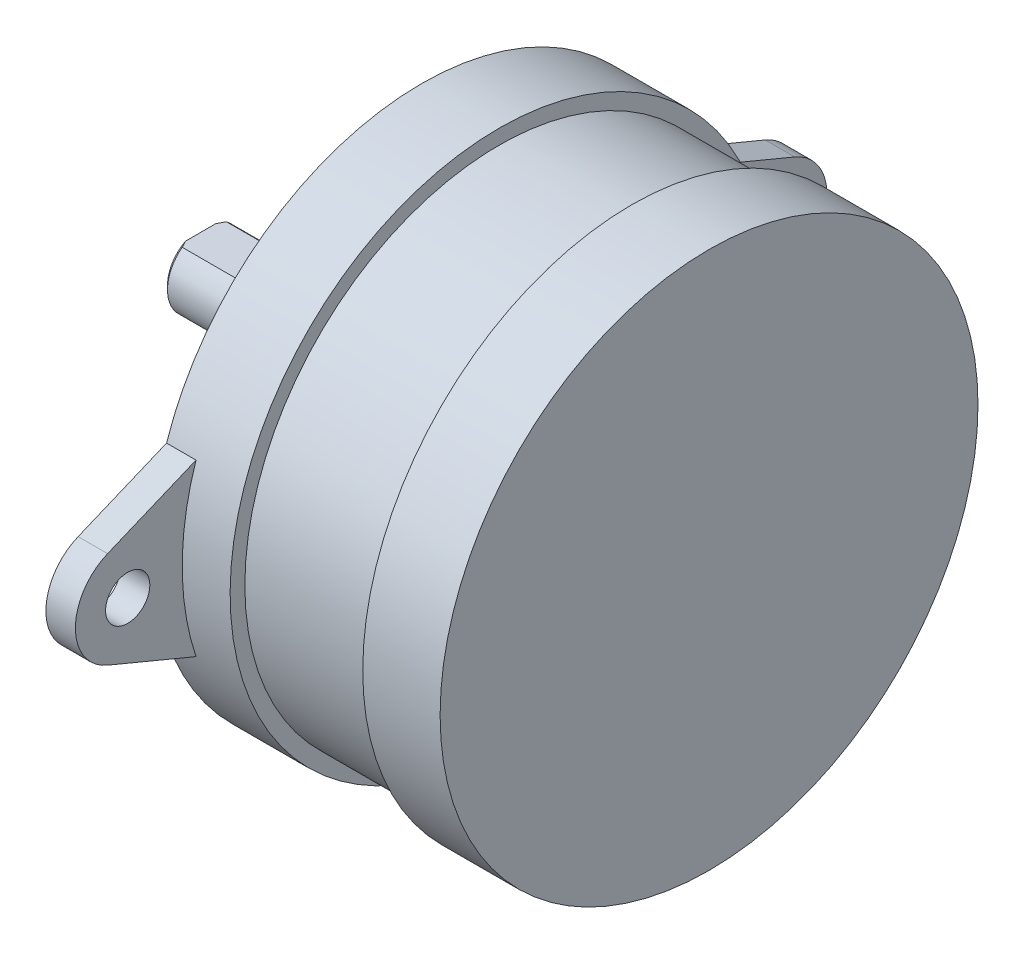
from build123d import *

# Parameters (mm, degrees)
ESQUISSE2_R             = 18.25
BOSS_EXTRU_1_DEPTH      = 5.25
ESQUISSE3_R             = 17.25
BOSS_EXTRU_2_DEPTH      = 9
ESQUISSE4_R             = 18.25
BOSS_EXTRU_3_DEPTH      = 5.25
ESQUISSE6_R             = 1.5
BOSS_EXTRU_4_DEPTH      = 2
ESQUISSE7_R             = 8
BOSS_EXTRU_5_DEPTH      = 2
ESQUISSE8_R             = 2.5
BOSS_EXTRU_6_DEPTH      = 15
CHANFREIN1_SIZE         = 0.25
ESQUISSE9_W             = 5
ESQUISSE9_H             = 1
ENL_V_MAT_EXTRU_1_DEPTH = 10


with BuildPart() as part:
    # Esquisse2 → Boss.-Extru.1 (new body)
    with BuildSketch(Plane(origin=(0, 0, 0), x_dir=(0, 0, -1), z_dir=(1, 0, 0))):
        with Locations(Location((0, 0, 0), (0, 0, 180))):
            Circle(ESQUISSE2_R)
    extrude(amount=BOSS_EXTRU_1_DEPTH)

    # Esquisse3 → Boss.-Extru.2 (add)
    with BuildSketch(Plane(origin=(5.25, 0, 0), x_dir=(0, 0, -1), z_dir=(1, 0, 0))):
        Circle(ESQUISSE3_R)
    extrude(amount=BOSS_EXTRU_2_DEPTH)

    # Esquisse4 → Boss.-Extru.3 (add)
    with BuildSketch(Plane(origin=(14.25, 0, 0), x_dir=(0, 0, -1), z_dir=(1, 0, 0))):
        with Locations(Location((0, 0, 0), (0, 0, 180))):
            Circle(ESQUISSE4_R)
    extrude(amount=BOSS_EXTRU_3_DEPTH)

    # Esquisse6 → Boss.-Extru.4 (add)
    # profile 1 of 2: a face of its own
    with BuildSketch(Plane.ZY):
        with BuildLine():
            ThreePointArc((23.313667029, -3.27763821), (25.5, 0), (23.313667029, 3.27763821))
            Line((23.313667029, 3.27763821), (17.312357631, 5.774493333))
            ThreePointArc((17.312357631, 5.774493333), (18.014064322, 2.925061814), (18.25, 0))
            ThreePointArc((18.25, 0), (18.014064322, -2.925061814), (17.312357631, -5.774493333))
            Line((17.312357631, -5.774493333), (23.313667029, -3.27763821))
        make_face()
        with Locations((21.95, 0)):
            Circle(ESQUISSE6_R, mode=Mode.SUBTRACT)
    # profile 2 of 2: a face of its own
    with BuildSketch(Plane.ZY):
        with BuildLine():
            ThreePointArc((-17.312357631, -5.774493333), (-18.25, 0), (-17.312357631, 5.774493333))
            Line((-17.312357631, 5.774493333), (-23.313667029, 3.27763821))
            ThreePointArc((-23.313667029, 3.27763821), (-25.5, 0), (-23.313667029, -3.27763821))
            Line((-23.313667029, -3.27763821), (-17.312357631, -5.774493333))
        make_face()
        with Locations((-21.95, 0)):
            Circle(ESQUISSE6_R, mode=Mode.SUBTRACT)
    extrude(amount=-BOSS_EXTRU_4_DEPTH)

    # Esquisse7 → Boss.-Extru.5 (add)
    with BuildSketch(Plane.ZY):
        Circle(ESQUISSE7_R)
    extrude(amount=BOSS_EXTRU_5_DEPTH)

    # Esquisse8 → Boss.-Extru.6 (add)
    with BuildSketch(Plane.ZY):
        Circle(ESQUISSE8_R)
    extrude(amount=BOSS_EXTRU_6_DEPTH)

    # Chanfrein1
    chanfrein1_edges = [part.edges().sort_by_distance(p)[0] for p in [
        (-15, 0, -2.5),
    ]]
    chamfer(chanfrein1_edges, length=CHANFREIN1_SIZE)

    # Esquisse9 → Enlèv. mat.-Extru.1 (cut)
    with BuildSketch(Plane.ZY.offset(15)):
        with Locations((0, 2.5)):
            Rectangle(ESQUISSE9_W, ESQUISSE9_H)
    extrude(amount=-ENL_V_MAT_EXTRU_1_DEPTH, mode=Mode.SUBTRACT)


solid = part.part
